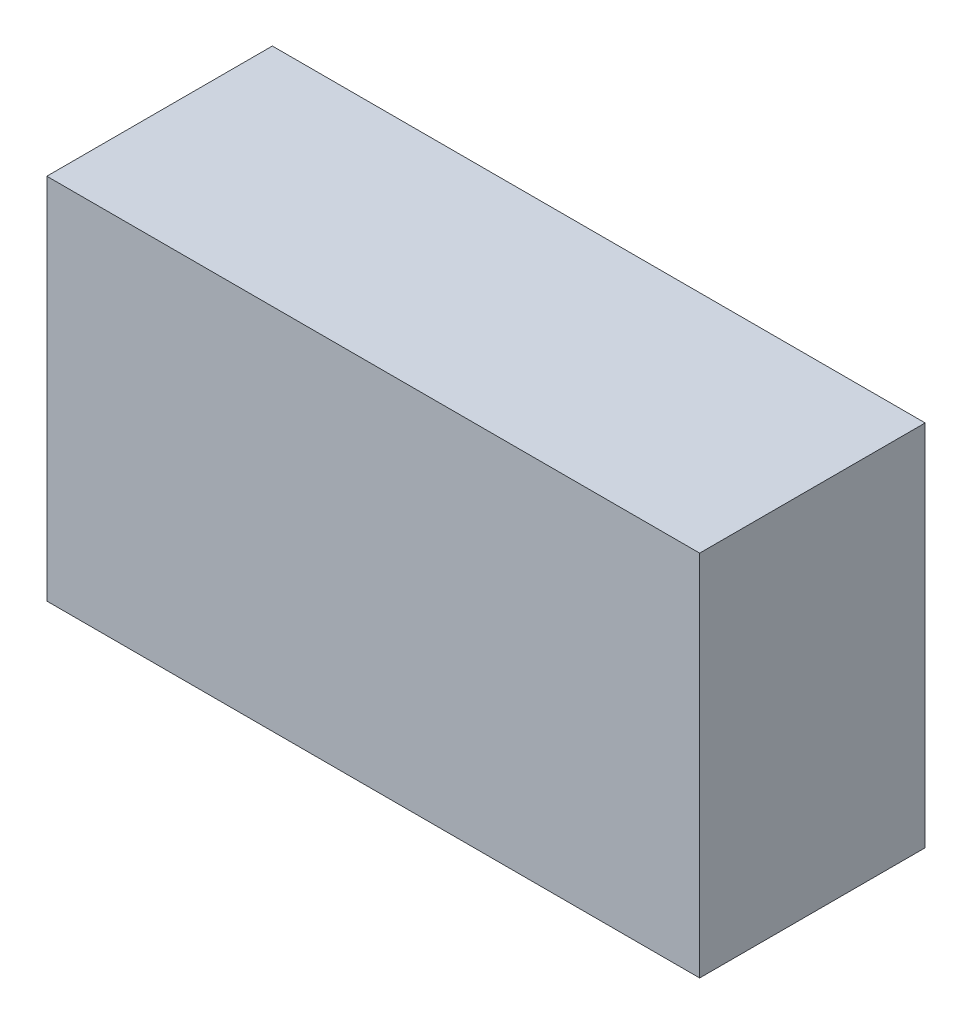
from build123d import *

# Parameters (mm, degrees)
SKETCH_1_W      = 55
SKETCH_1_H      = 31
EXTRUDE_1_DEPTH = 19


with BuildPart() as part:
    # 草图1 → 凸台-拉伸1 (new body)
    with BuildSketch(Plane.XY):
        with Locations((-14.568196801, 34.356403333)):
            Rectangle(SKETCH_1_W, SKETCH_1_H)
    extrude(amount=EXTRUDE_1_DEPTH)


solid = part.part
